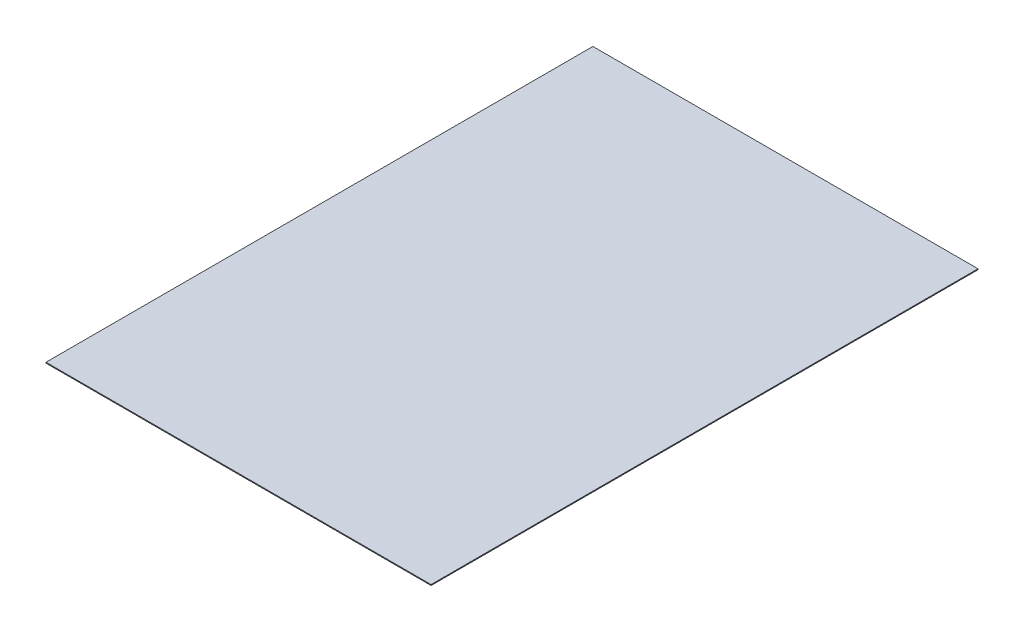
from build123d import *

# Parameters (mm, degrees)
SKETCH1_W           = 2000
SKETCH1_H           = 2000
BOSS_EXTRUDE1_DEPTH = 3.175
SKETCH4_W           = 591.824229309
SKETCH4_H           = 2000
CUT_EXTRUDE1_DEPTH  = 2829.428906765


with BuildPart() as part:
    # Sketch1 → Boss-Extrude1 (new body)
    with BuildSketch(Plane(origin=(0, 0, 0), x_dir=(1, 0, 0), z_dir=(0, 1, 0))):
        with Locations((1000, -1000)):
            Rectangle(SKETCH1_W, SKETCH1_H)
    extrude(amount=BOSS_EXTRUDE1_DEPTH)

    # Sketch4 → Cut-Extrude1 (cut, through all)
    with BuildSketch(Plane(origin=(0, 3.175, 0), x_dir=(1, 0, 0), z_dir=(0, 1, 0))):
        with Locations((295.912114655, -1000)):
            Rectangle(SKETCH4_W, SKETCH4_H)
    extrude(amount=-CUT_EXTRUDE1_DEPTH, mode=Mode.SUBTRACT)


solid = part.part
